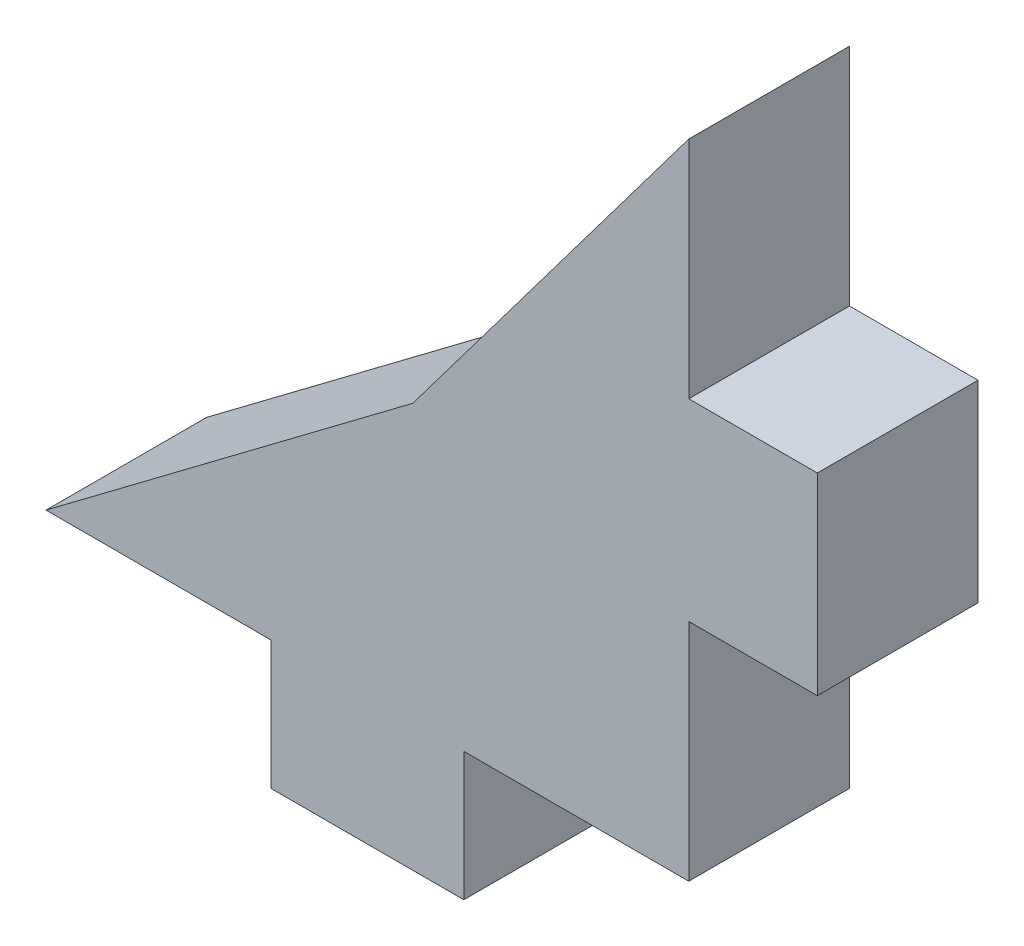
from build123d import *

# Parameters (mm, degrees)
EXTRUDE_1_DEPTH     = 5
CUT_EXTRUDE_1_DEPTH = 5
EXTRUDE_2_DEPTH     = 5
EXTRUDE_3_DEPTH     = 5
SKETCH_5_W          = 6
SKETCH_5_H          = 5
CUT_EXTRUDE_2_DEPTH = 1
SKETCH_6_W          = 5
SKETCH_6_H          = 6
CUT_EXTRUDE_3_DEPTH = 1


with BuildPart() as part:
    # 草图1 → 凸台-拉伸1 (new body)
    with BuildSketch(Plane.XY):
        Polygon((0, 0), (-20, 0), (0, 20), align=None)
    extrude(amount=EXTRUDE_1_DEPTH)

    # 草图2 → 切除-拉伸1 (cut)
    with BuildSketch(Plane.XY.offset(5)):
        Polygon((-8.585786438, 8.585786438), (-10, 10), (-20, 0), align=None)
        Polygon((-8.585786438, 8.585786438), (0, 20), (-10, 10), align=None)
    extrude(amount=-CUT_EXTRUDE_1_DEPTH, mode=Mode.SUBTRACT)

    # 草图3 → 凸台-拉伸2 (add)
    with BuildSketch(Plane.XZ):
        Polygon((-10, 0), (-13, 0), (-13, 5), (-7, 5), (-7, 0), align=None)
    extrude(amount=EXTRUDE_2_DEPTH)

    # 草图4 → 凸台-拉伸3 (add)
    with BuildSketch(Plane(origin=(0, 0, 0), x_dir=(0, 0, -1), z_dir=(1, 0, 0))):
        Polygon((0, 10), (0, 7), (-5, 7), (-5, 13), (0, 13), align=None)
    extrude(amount=EXTRUDE_3_DEPTH)

    # 草图5 → 切除-拉伸2 (cut)
    with BuildSketch(Plane.XZ.offset(5)):
        with Locations((-10, 2.5)):
            Rectangle(SKETCH_5_W, SKETCH_5_H)
    extrude(amount=-CUT_EXTRUDE_2_DEPTH, mode=Mode.SUBTRACT)

    # 草图6 → 切除-拉伸3 (cut)
    with BuildSketch(Plane(origin=(5, 0, 0), x_dir=(0, 0, -1), z_dir=(1, 0, 0))):
        with Locations((-2.5, 10)):
            Rectangle(SKETCH_6_W, SKETCH_6_H)
    extrude(amount=-CUT_EXTRUDE_3_DEPTH, mode=Mode.SUBTRACT)


solid = part.part
